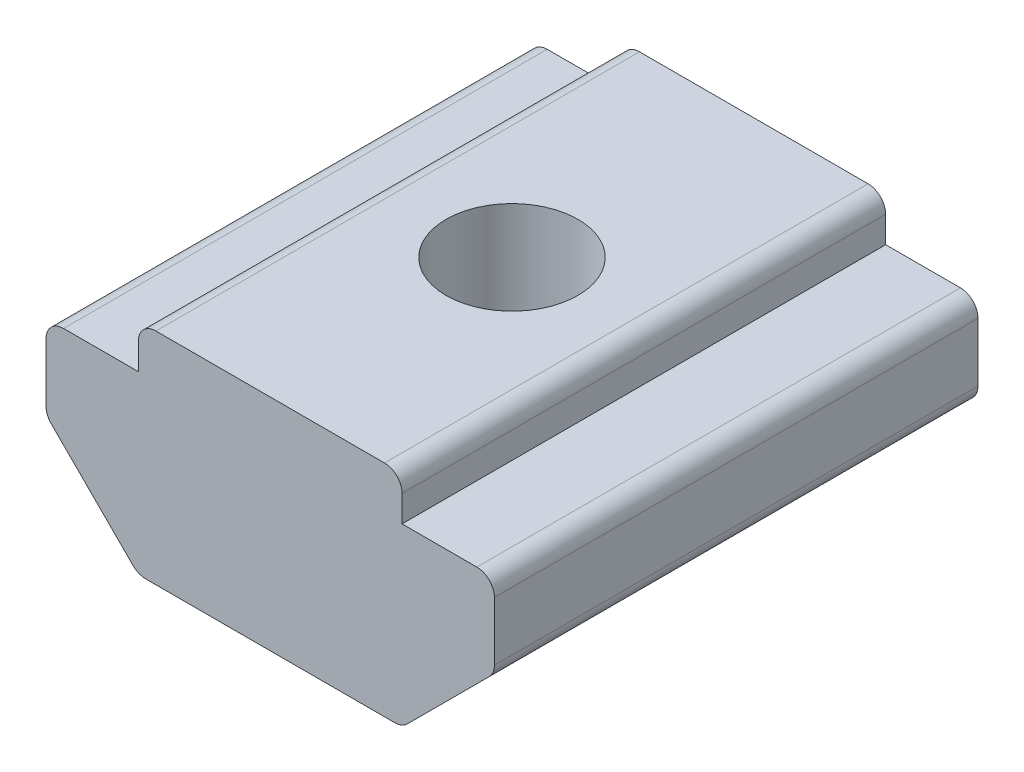
from build123d import *

# Parameters (mm, degrees)
EXTRUDE_1_DEPTH     = 5.5
SKETCH_2_R          = 1.5
CUT_EXTRUDE_1_DEPTH = 10.014432872
FILLET_1_R          = 0.4


with BuildPart() as part:
    # 草图1 → 凸台-拉伸1 (new, symmetric)
    with BuildSketch(Plane.XY):
        Polygon((-5.1, 0), (-3, 0), (-3, 1), (3, 1), (3, 0), (5.1, 0), (5.1, -1.9), (3, -4), (-3, -4), (-5.1, -1.9), align=None)
    extrude(amount=EXTRUDE_1_DEPTH, both=True)

    # 草图2 → 切除-拉伸1 (cut, through all)
    with BuildSketch(Plane(origin=(0, 1, 0), x_dir=(1, 0, 0), z_dir=(0, 1, 0))):
        with Locations(Location((0, 0, 0), (0, 0, 270))):
            Circle(SKETCH_2_R)
    extrude(amount=-CUT_EXTRUDE_1_DEPTH, mode=Mode.SUBTRACT)

    # 圆角1
    fillet_1_edges = [part.edges().sort_by_distance(p)[0] for p in [
        (-5.1, 0, 0),
        (-3, 1, 0),
        (3, 1, 0),
        (5.1, 0, 0),
        (5.1, -1.9, 0),
        (3, -4, 0),
        (-3, -4, 0),
        (-5.1, -1.9, 0),
    ]]
    fillet(fillet_1_edges, radius=FILLET_1_R)


solid = part.part
